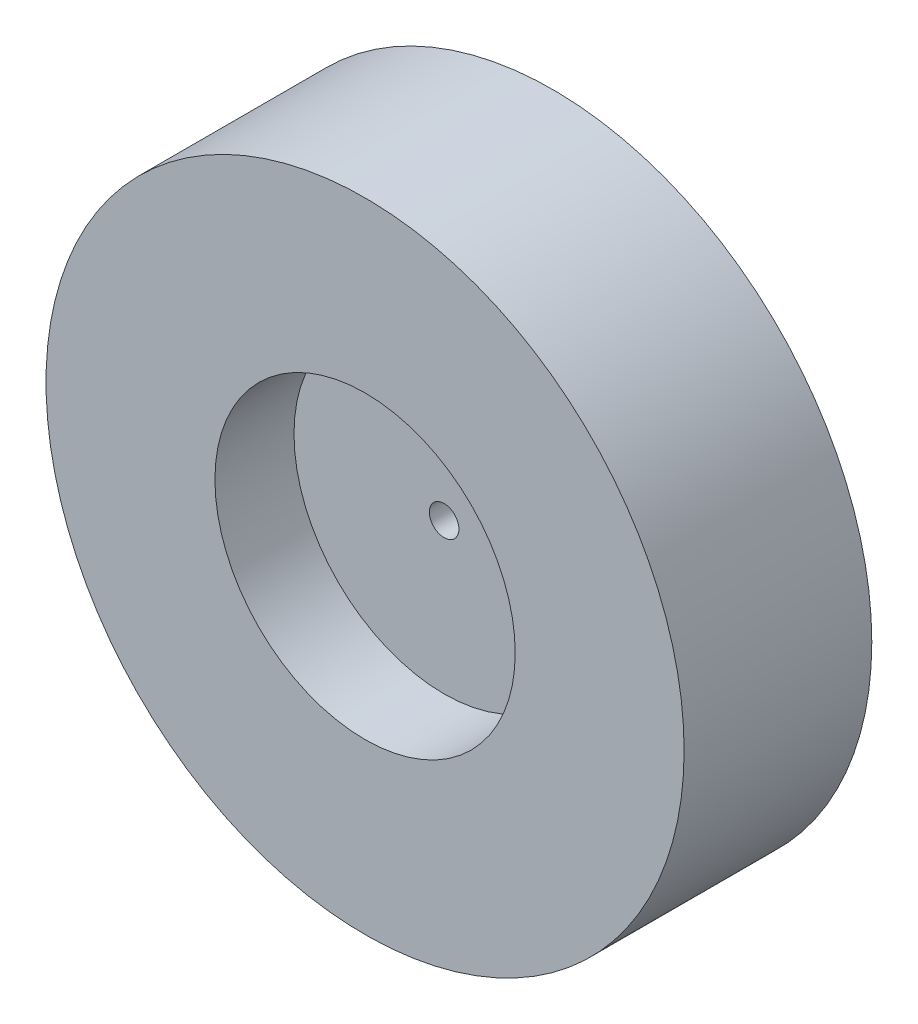
from build123d import *

# Parameters (mm, degrees)
SKETCH1_R           = 107.95
SKETCH1_R_2         = 50.8
BOSS_EXTRUDE1_DEPTH = 31.75
SKETCH2_R           = 50.8
SKETCH2_R_2         = 5
BOSS_EXTRUDE2_DEPTH = 5


with BuildPart() as part:
    # Sketch1 → Boss-Extrude1 (new, symmetric)
    with BuildSketch(Plane.XY):
        Circle(SKETCH1_R)
        Circle(SKETCH1_R_2, mode=Mode.SUBTRACT)
    extrude(amount=BOSS_EXTRUDE1_DEPTH, both=True)

    # Sketch2 → Boss-Extrude2 (add, symmetric)
    with BuildSketch(Plane.XY):
        Circle(SKETCH2_R)
        Circle(SKETCH2_R_2, mode=Mode.SUBTRACT)
    extrude(amount=BOSS_EXTRUDE2_DEPTH, both=True)


solid = part.part
